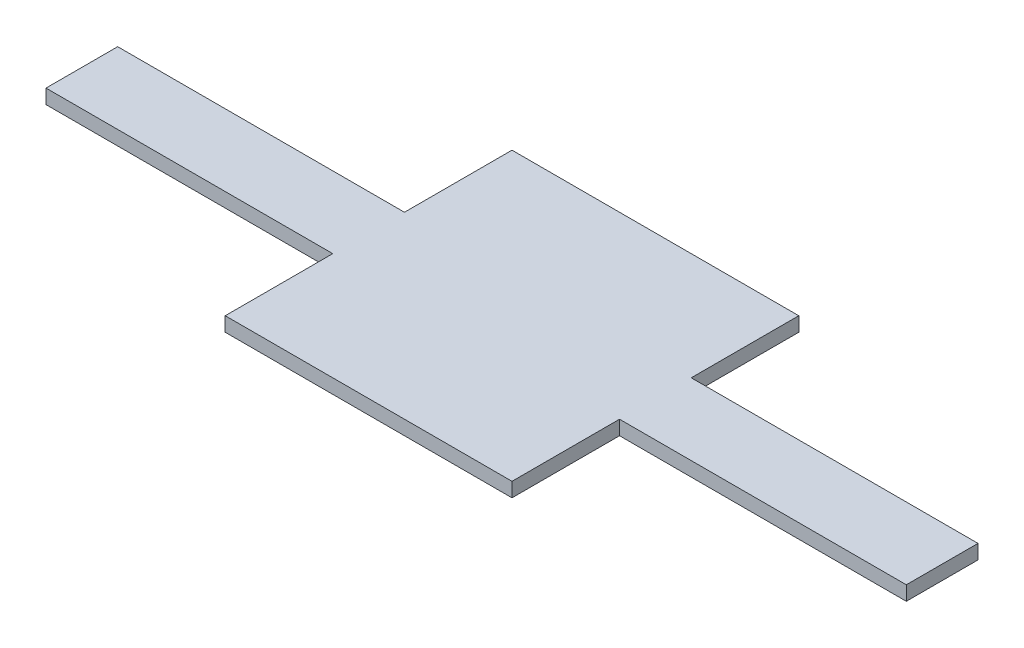
from build123d import *

# Parameters (mm, degrees)
CROQUIS1_W                   = 10
CROQUIS1_H                   = 10
SALIENTE_EXTRUIR1_DEPTH      = 0.5
SALIENTE_EXTRUIR2_DEPTH      = 10
SALIENTE_EXTRUIR2_DEPTH_BACK = 20
CROQUIS2_W                   = 2.5
CROQUIS2_H                   = 0.5


with BuildPart() as part:
    # Croquis1 → Saliente-Extruir1 (new body)
    with BuildSketch(Plane(origin=(0, 0, 0), x_dir=(1, 0, 0), z_dir=(0, 1, 0))):
        with Locations((5, 5)):
            Rectangle(CROQUIS1_W, CROQUIS1_H)
    extrude(amount=SALIENTE_EXTRUIR1_DEPTH)

    # Croquis2 → Saliente-Extruir2 (add, two sides: drawn at the far end of the back side and taken through both)
    with BuildSketch(Plane(origin=(10, 0, 0), x_dir=(0, 0, -1), z_dir=(1, 0, 0)).offset(-SALIENTE_EXTRUIR2_DEPTH_BACK)):
        with Locations((5, 0.25)):
            Rectangle(CROQUIS2_W, CROQUIS2_H)
    extrude(amount=SALIENTE_EXTRUIR2_DEPTH + SALIENTE_EXTRUIR2_DEPTH_BACK)


solid = part.part
